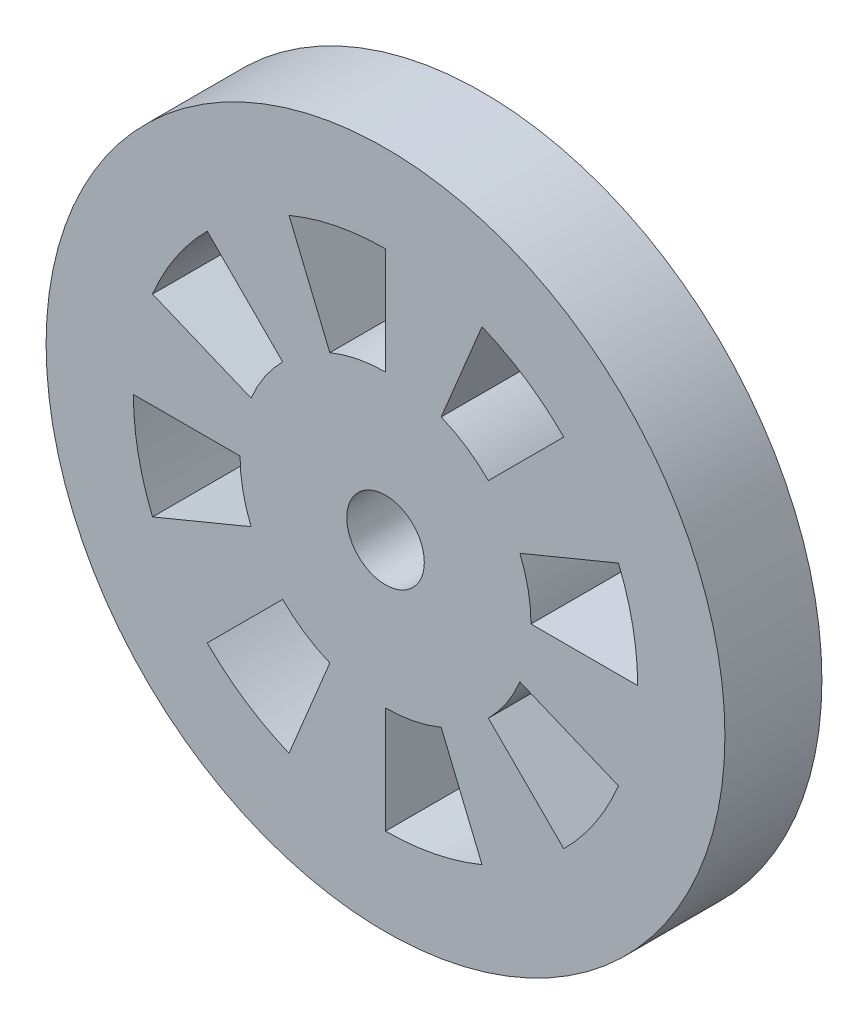
from build123d import *

# Parameters (mm, degrees)
SKETCH2_R           = 3.5
BOSS_EXTRUDE1_DEPTH = 1
SKETCH4_R           = 0.4
CUT_EXTRUDE2_DEPTH  = 6.049752469
CUT_EXTRUDE3_DEPTH  = 6.049752469
CIRPATTERN1_COUNT   = 8


with BuildPart() as part:
    # Sketch2 → Boss-Extrude1 (new body)
    with BuildSketch(Plane.XY):
        Circle(SKETCH2_R)
    extrude(amount=BOSS_EXTRUDE1_DEPTH)

    # Sketch4 → Cut-Extrude2 (cut, through all)
    with BuildSketch(Plane.XY.offset(1)):
        Circle(SKETCH4_R)
    extrude(amount=-CUT_EXTRUDE2_DEPTH, mode=Mode.SUBTRACT)

    # Sketch5 → Cut-Extrude3 (cut, through all)
    with BuildSketch(Plane.XY.offset(1)):
        with BuildLine():
            Line((-1.060660172, -1.060660172), (-1.838477631, -1.838477631))
            ThreePointArc((-1.838477631, -1.838477631), (-1.444482606, -2.161820992), (-0.994976924, -2.402086785))
            Line((-0.994976924, -2.402086785), (-0.574025149, -1.385819299))
            ThreePointArc((-0.574025149, -1.385819299), (-0.83335535, -1.247204418), (-1.060660172, -1.060660172))
        make_face()
    cut_extrude3 = extrude(amount=-CUT_EXTRUDE3_DEPTH, mode=Mode.SUBTRACT)

    # CirPattern1: Cut-Extrude3 ×8 about axis
    cirpattern1_axis = Axis((0, 0, 0), (0, 0, 1))
    for i in range(1, CIRPATTERN1_COUNT):
        add(cut_extrude3.rotate(cirpattern1_axis, i * 360 / CIRPATTERN1_COUNT), mode=Mode.SUBTRACT)


solid = part.part
